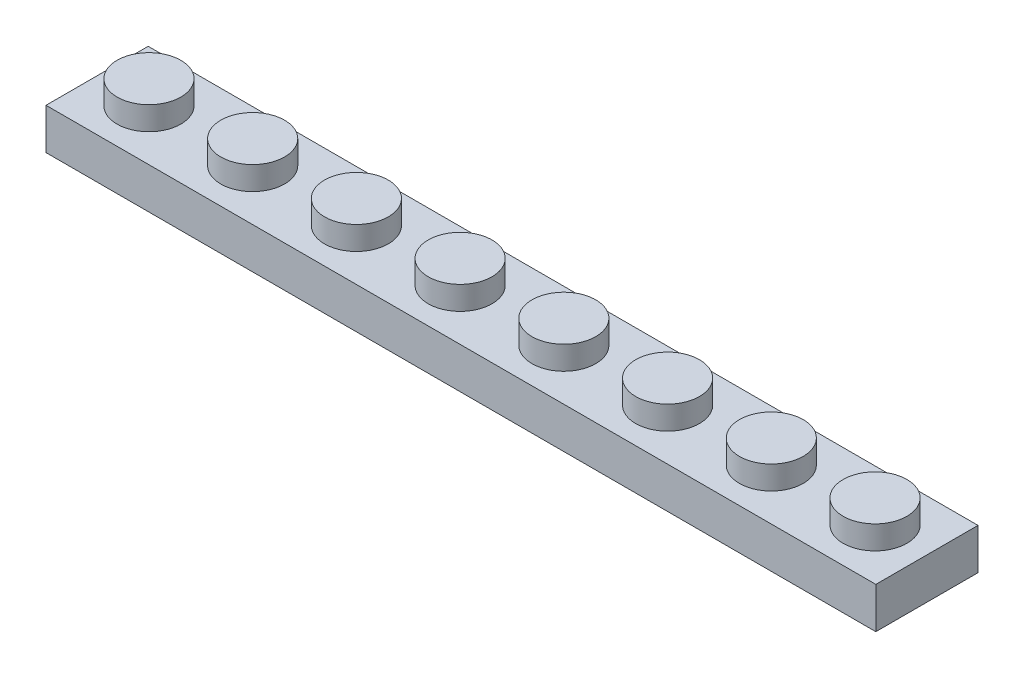
from build123d import *

# Parameters (mm, degrees)
SKETCH2_W           = 63.75
SKETCH2_H           = 7.85
BOSS_EXTRUDE1_DEPTH = 3.15
SKETCH3_R           = 2.45
BOSS_EXTRUDE2_DEPTH = 1.8
SHELL1_T            = -1.5
SKETCH4_R           = 1.5
SKETCH4_R_2         = 0.8
BOSS_EXTRUDE3_DEPTH = 1.45


with BuildPart() as part:
    # Sketch2 → Boss-Extrude1 (new body)
    with BuildSketch(Plane(origin=(0, 0, 0), x_dir=(1, 0, 0), z_dir=(0, 1, 0))):
        Rectangle(SKETCH2_W, SKETCH2_H)
    extrude(amount=-BOSS_EXTRUDE1_DEPTH)

    # Sketch3 → Boss-Extrude2 (add)
    with BuildSketch(Plane(origin=(0, 0, 0), x_dir=(1, 0, 0), z_dir=(0, 1, 0))):
        with Locations(Location((-27.890625, 0, 0), (0, 0, 270))):
            Circle(SKETCH3_R)
        with Locations(Location((-19.921875, 0, 0), (0, 0, 270))):
            Circle(SKETCH3_R)
        with Locations(Location((-11.953125, 0, 0), (0, 0, 270))):
            Circle(SKETCH3_R)
        with Locations(Location((-3.984375, 0, 0), (0, 0, 270))):
            Circle(SKETCH3_R)
        with Locations(Location((3.984375, 0, 0), (0, 0, 270))):
            Circle(SKETCH3_R)
        with Locations(Location((11.953125, 0, 0), (0, 0, 270))):
            Circle(SKETCH3_R)
        with Locations(Location((19.921875, 0, 0), (0, 0, 270))):
            Circle(SKETCH3_R)
        with Locations(Location((27.890625, 0, 0), (0, 0, 270))):
            Circle(SKETCH3_R)
    extrude(amount=BOSS_EXTRUDE2_DEPTH)

    # Shell1
    shell1_openings = [part.faces().sort_by_distance(p)[0] for p in [
        (0, -3.15, 0),
    ]]
    offset(amount=SHELL1_T, openings=shell1_openings, kind=Kind.INTERSECTION)

    # Sketch4 → Boss-Extrude3 (add)
    # profile 1 of 7: a face of its own
    with BuildSketch(Plane.XZ.offset(1.5)):
        with Locations(Location((-23.90625, 0, 0), (0, 0, 90))):
            Circle(SKETCH4_R)
        with Locations(Location((-23.90625, 0, 0), (0, 0, 90))):
            Circle(SKETCH4_R_2, mode=Mode.SUBTRACT)
    # profile 2 of 7: a face of its own
    with BuildSketch(Plane.XZ.offset(1.5)):
        with Locations(Location((-15.9375, 0, 0), (0, 0, 90))):
            Circle(SKETCH4_R)
        with Locations(Location((-15.9375, 0, 0), (0, 0, 90))):
            Circle(SKETCH4_R_2, mode=Mode.SUBTRACT)
    # profile 3 of 7: a face of its own
    with BuildSketch(Plane.XZ.offset(1.5)):
        with Locations(Location((-7.96875, 0, 0), (0, 0, 90))):
            Circle(SKETCH4_R)
        with Locations(Location((-7.96875, 0, 0), (0, 0, 90))):
            Circle(SKETCH4_R_2, mode=Mode.SUBTRACT)
    # profile 4 of 7: a face of its own
    with BuildSketch(Plane.XZ.offset(1.5)):
        with Locations(Location((0, 0, 0), (0, 0, 90))):
            Circle(SKETCH4_R)
        with Locations(Location((0, 0, 0), (0, 0, 90))):
            Circle(SKETCH4_R_2, mode=Mode.SUBTRACT)
    # profile 5 of 7: a face of its own
    with BuildSketch(Plane.XZ.offset(1.5)):
        with Locations(Location((7.96875, 0, 0), (0, 0, 90))):
            Circle(SKETCH4_R)
        with Locations(Location((7.96875, 0, 0), (0, 0, 90))):
            Circle(SKETCH4_R_2, mode=Mode.SUBTRACT)
    # profile 6 of 7: a face of its own
    with BuildSketch(Plane.XZ.offset(1.5)):
        with Locations(Location((15.9375, 0, 0), (0, 0, 90))):
            Circle(SKETCH4_R)
        with Locations(Location((15.9375, 0, 0), (0, 0, 90))):
            Circle(SKETCH4_R_2, mode=Mode.SUBTRACT)
    # profile 7 of 7: a face of its own
    with BuildSketch(Plane.XZ.offset(1.5)):
        with Locations(Location((23.90625, 0, 0), (0, 0, 90))):
            Circle(SKETCH4_R)
        with Locations(Location((23.90625, 0, 0), (0, 0, 90))):
            Circle(SKETCH4_R_2, mode=Mode.SUBTRACT)
    extrude(amount=BOSS_EXTRUDE3_DEPTH)


solid = part.part
